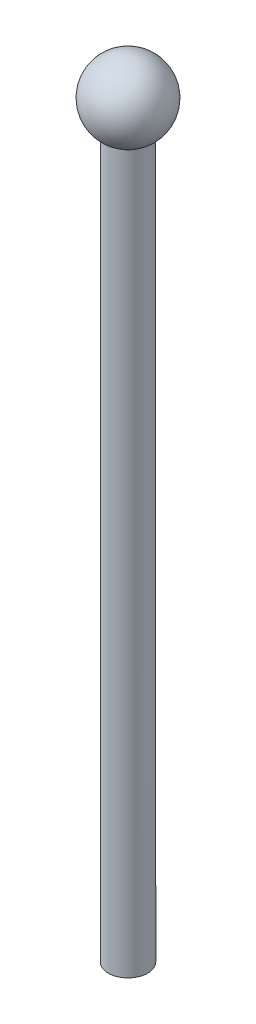
from build123d import *
from build123d.topology import SkipClean


with BuildPart() as part:
    # Sketch1 → Revolve1 (revolve)
    with SkipClean():  # the faces are left unmerged after this step: merging them gives an invalid solid
        with BuildSketch(Plane.XY):
            with BuildLine():
                ThreePointArc((3.75, 0), (2.651650429, 2.651650429), (0, 3.75))
                Line((0, 3.75), (0, -3.75))
                ThreePointArc((0, -3.75), (2.651650429, -2.651650429), (3.75, 0))
            make_face()
            with BuildLine():
                Line((0, -3.75), (0, 3.75))
                ThreePointArc((0, 3.75), (-3.602640798, 1.040903107), (-2, -3.172144385))
                ThreePointArc((-2, -3.172144385), (-1.040903107, -3.602640798), (0, -3.75))
            make_face()
            with BuildLine():
                Line((0, -76.25), (0, -3.75))
                ThreePointArc((0, -3.75), (-1.040903107, -3.602640798), (-2, -3.172144385))
                Line((-2, -3.172144385), (-2, -76.25))
                Line((-2, -76.25), (0, -76.25))
            make_face()
        revolve(axis=Axis((0, 3.75, 0), (0, -1, 0)))


solid = part.part
